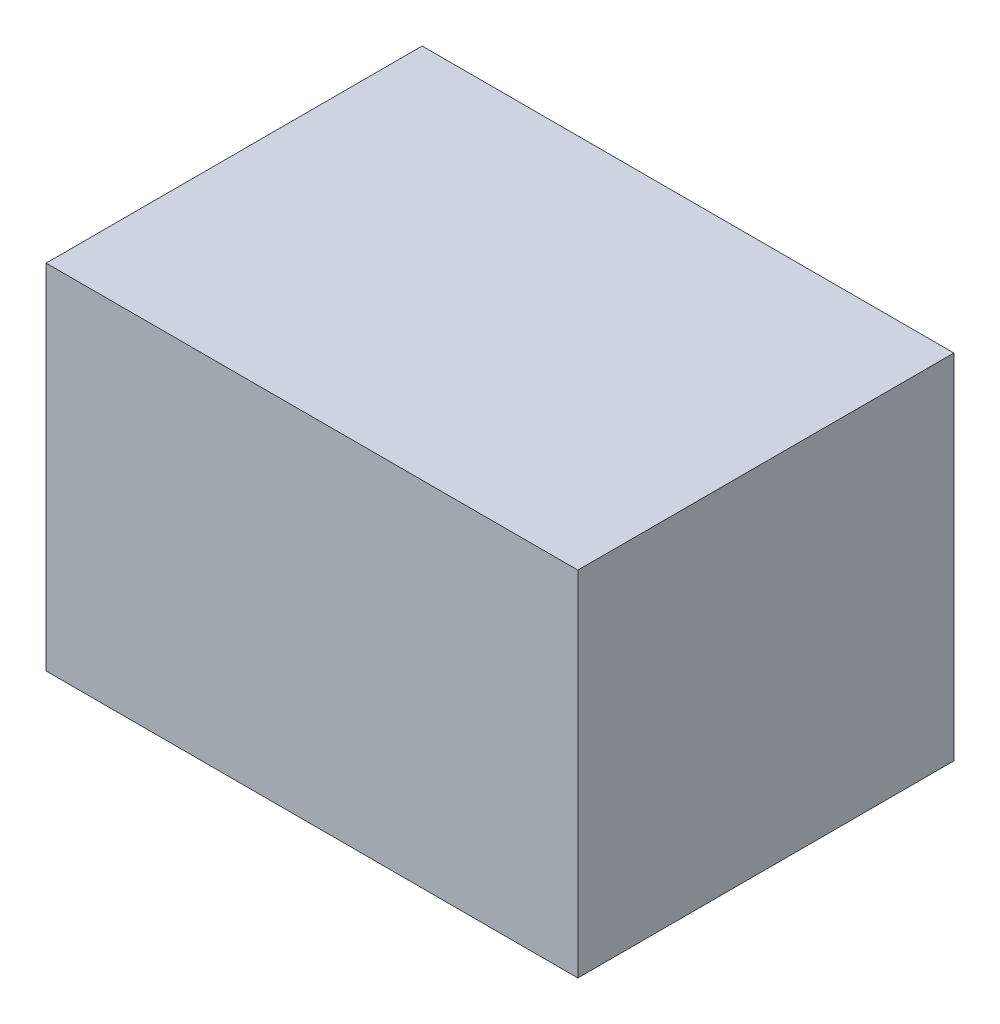
from build123d import *

# Parameters (mm, degrees)
SKETCH1_W           = 280
SKETCH1_H           = 198
BOSS_EXTRUDE1_DEPTH = 186


with BuildPart() as part:
    # Sketch1 → Boss-Extrude1 (new body)
    with BuildSketch(Plane(origin=(0, 0, 0), x_dir=(1, 0, 0), z_dir=(0, 1, 0))):
        with Locations((-572.084337349, 172.951807229)):
            Rectangle(SKETCH1_W, SKETCH1_H)
    extrude(amount=BOSS_EXTRUDE1_DEPTH)


solid = part.part
